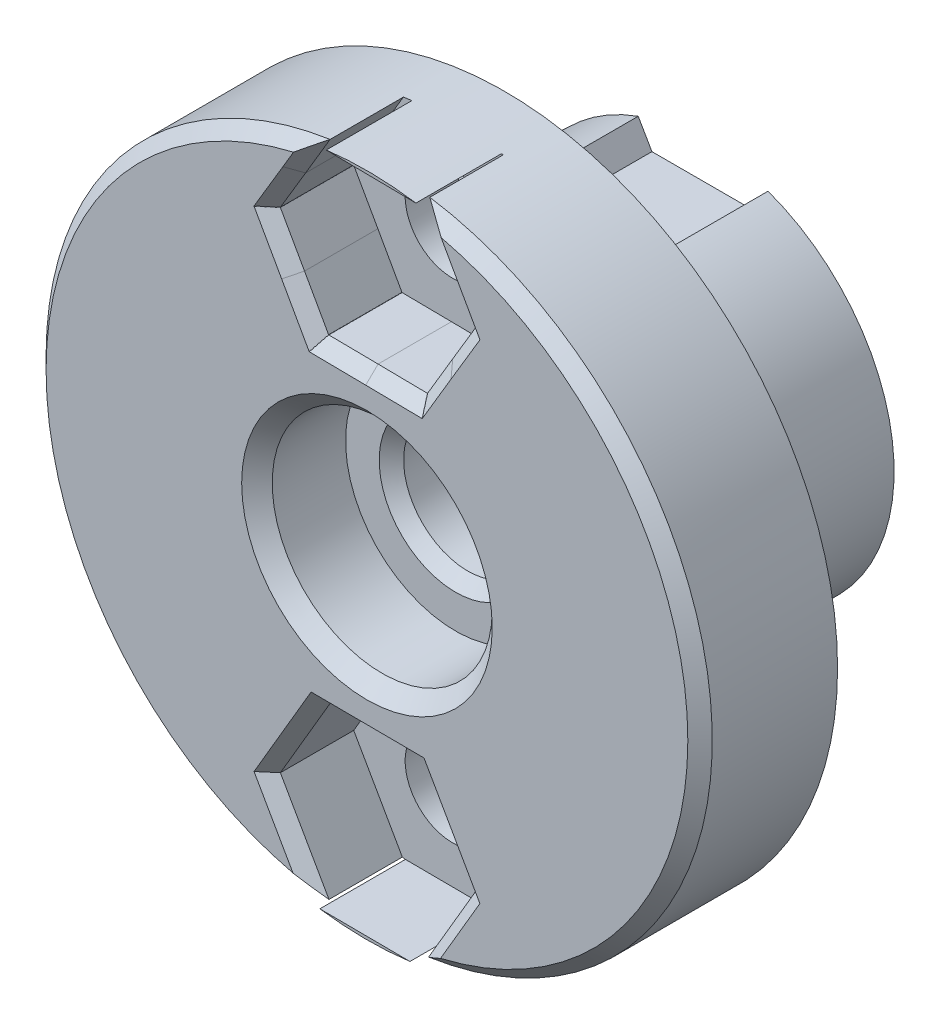
from build123d import *

# Parameters (mm, degrees)
SKETCH2_R           = 10.9
SKETCH2_R_2         = 1.55
BOSS_EXTRUDE1_DEPTH = 4.5
SKETCH3_R           = 6.25
SKETCH3_R_2         = 2.1
BOSS_EXTRUDE2_DEPTH = 6.5
CUT_EXTRUDE2_START  = -9.5
SKETCH6_R           = 2.1
CUT_EXTRUDE2_DEPTH  = 9.5
SKETCH7_R           = 3.6
CUT_EXTRUDE3_DEPTH  = 2.9
CUT_EXTRUDE4_DEPTH  = 2.8
CHAMFER2_SIZE       = 0.5
SKETCH11_R          = 1.55
CUT_EXTRUDE5_DEPTH  = 5.5
SKETCH14_W          = 2.8
SKETCH14_H          = 6.2
CUT_EXTRUDE6_DEPTH  = 6.4
CUT_EXTRUDE8_DEPTH  = 6.2
CHAMFER3_SIZE       = 0.4
CHAMFER4_SIZE       = 0.4
SKETCH19_W          = 2.5
SKETCH19_H          = 7
BOSS_EXTRUDE4_DEPTH = 10
FILLET5_R           = 3
CUT_EXTRUDE9_DEPTH  = 6.5
CUT_EXTRUDE10_START = -87
SKETCH21_R          = 1.55
CUT_EXTRUDE10_DEPTH = 87


with BuildPart() as part:
    # Sketch2 → Boss-Extrude1 (new body)
    with BuildSketch(Plane.XY):
        Circle(SKETCH2_R)
        with Locations((0, 8)):
            Circle(SKETCH2_R_2, mode=Mode.SUBTRACT)
        with Locations((0, -8)):
            Circle(SKETCH2_R_2, mode=Mode.SUBTRACT)
    extrude(amount=BOSS_EXTRUDE1_DEPTH)

    # Sketch3 → Boss-Extrude2 (add)
    with BuildSketch(Plane(origin=(0, 0, 0), x_dir=(-1, 0, 0), z_dir=(0, 0, -1))):
        with Locations(Location((0, 0, 0), (0, 0, 180))):
            Circle(SKETCH3_R)
        with Locations(Location((0, 0, 0), (0, 0, 180))):
            Circle(SKETCH3_R_2, mode=Mode.SUBTRACT)
    extrude(amount=BOSS_EXTRUDE2_DEPTH)

    # Sketch6 → Cut-Extrude2 (cut)
    with BuildSketch(Plane(origin=(0, 0, 0), x_dir=(-1, 0, 0), z_dir=(0, 0, -1)).offset(CUT_EXTRUDE2_START)):
        with Locations(Location((0, 0, 0), (0, 0, 180))):
            Circle(SKETCH6_R)
    extrude(amount=CUT_EXTRUDE2_DEPTH, mode=Mode.SUBTRACT)

    # Sketch7 → Cut-Extrude3 (cut)
    with BuildSketch(Plane.XY.offset(4.5)):
        Circle(SKETCH7_R)
    extrude(amount=-CUT_EXTRUDE3_DEPTH, mode=Mode.SUBTRACT)

    # Sketch8 → Cut-Extrude4 (cut)
    with BuildSketch(Plane.XY.offset(4.5)):
        Polygon((1.58395502, 5.181415279), (3.232943481, 7.962452926), (1.64898846, 10.781037646), (-1.58395502, 10.818584721), (-3.232943481, 8.037547074), (-1.64898846, 5.218962354), align=None)
        Polygon((3.233098906, -8.020119499), (1.633973451, -5.210113964), (-1.599125456, -5.189994464), (-3.233098906, -7.979880501), (-1.633973451, -10.789886036), (1.599125456, -10.810005536), align=None)
    extrude(amount=-CUT_EXTRUDE4_DEPTH, mode=Mode.SUBTRACT)

    # Chamfer2
    chamfer2_edges = [part.edges().sort_by_distance(p)[0] for p in [
        (-3.6, 0, 4.5),
    ]]
    chamfer(chamfer2_edges, length=CHAMFER2_SIZE)

    # Sketch11 → Cut-Extrude5 (cut, symmetric)
    with BuildSketch(Plane(origin=(-6.25, 0, 0), x_dir=(0, 1, 0), z_dir=(-1, 0, 0))):
        with Locations(Location((0, 3.215789821, 0), (0, 0, 270))):
            Circle(SKETCH11_R)
    extrude(amount=CUT_EXTRUDE5_DEPTH, both=True, mode=Mode.SUBTRACT)

    # Sketch14 → Cut-Extrude6 (cut)
    with BuildSketch(Plane(origin=(0, 0, -6.5), x_dir=(-1, 0, 0), z_dir=(0, 0, -1))):
        with Locations((3.35, 0)):
            Rectangle(SKETCH14_W, SKETCH14_H)
    extrude(amount=-CUT_EXTRUDE6_DEPTH, mode=Mode.SUBTRACT)

    # Sketch17 → Cut-Extrude8 (cut)
    with BuildSketch(Plane.XY.offset(1.7)):
        Polygon((1.655062081, 10.777427379), (-1.577791627, 10.822039496), (-3.232853707, 8.044612117), (-1.655062081, 5.222572621), (1.577791627, 5.177960504), (3.232853707, 7.955387883), align=None)
    extrude(amount=CUT_EXTRUDE8_DEPTH, mode=Mode.SUBTRACT)

    # Chamfer3
    chamfer3_edges = [part.edges().sort_by_distance(p)[0] for p in [
        (3.231903858, 7.96069959, 4.5),
        (-1.649987082, 5.220739361, 4.5),
        (1.581916776, 5.181438951, 4.5),
        (-3.231903858, 8.03930041, 4.5),
        (-3.231858971, 8.042832931, 4.5),
        (0.771107805, 5.189092426, 4.5),
        (2.049929575, 10.07116703, 4.5),
        (1.578835079, 5.179711564, 4.5),
        (3.231858971, 7.957167069, 4.5),
        (-2.81987127, 8.737654839, 4.5),
        (-2.048763464, 5.926747264, 4.5),
        (-1.653023892, 5.222544495, 4.5),
        (2.81987127, 7.262345161, 4.5),
        (-10.899984913, 0.01813521, 4.5),
        (8.259417425, -7.112807026, 4.5),
        (2.837704165, 8.665765509, 4.5),
        (-2.006564209, 10.105849554, 4.5),
        (-2.837704165, 7.334234491, 4.5),
        (-0.842282238, 5.20959335, 4.5),
        (1.995421926, 5.87535886, 4.5),
        (-2.437601998, -9.377738754, 4.5),
        (2.42507938, -9.399751703, 4.5),
        (2.433536179, -6.615116731, 4.5),
        (0.017423997, -5.200054214, 4.5),
        (-2.416112181, -6.584937483, 4.5),
    ]]
    chamfer(chamfer3_edges, length=CHAMFER3_SIZE)

    # Chamfer4
    chamfer4_edges = [part.edges().sort_by_distance(p)[0] for p in [
        (-2.1, 0, 1.6),
    ]]
    chamfer(chamfer4_edges, length=CHAMFER4_SIZE)

    # Sketch19 → Boss-Extrude4 (add)
    with BuildSketch(Plane(origin=(0, 0, -6.5), x_dir=(-1, 0, 0), z_dir=(0, 0, -1))):
        with Locations((6.327927724, 0)):
            Rectangle(SKETCH19_W, SKETCH19_H)
    extrude(amount=-BOSS_EXTRUDE4_DEPTH)

    # Fillet5
    fillet5_edges = [part.edges().sort_by_distance(p)[0] for p in [
        (-5.178078794, -3.5, -3.25),
        (-5.178078794, 3.5, -3.25),
    ]]
    fillet(fillet5_edges, radius=FILLET5_R)

    # Sketch20 → Cut-Extrude9 (cut)
    with BuildSketch(Plane(origin=(0, 0, -6.5), x_dir=(-1, 0, 0), z_dir=(0, 0, -1))):
        Polygon((1.674315781, 10.9), (-1.674315781, 10.9), (-3.348631561, 8), (-1.674315781, 5.1), (1.674315781, 5.1), (3.348631561, 8), align=None)
        Polygon((1.674315781, -5.1), (-1.674315781, -5.1), (-3.348631561, -8), (-1.674315781, -10.9), (1.674315781, -10.9), (3.348631561, -8), align=None)
    extrude(amount=-CUT_EXTRUDE9_DEPTH, mode=Mode.SUBTRACT)

    # Sketch21 → Cut-Extrude10 (cut)
    with BuildSketch(Plane(origin=(-5.077927724, 0, 0), x_dir=(0, 0, -1), z_dir=(1, 0, 0)).offset(CUT_EXTRUDE10_START)):
        with Locations(Location((3.215789821, 0, 0), (0, 0, 180))):
            Circle(SKETCH21_R)
    extrude(amount=CUT_EXTRUDE10_DEPTH, mode=Mode.SUBTRACT)


solid = part.part
